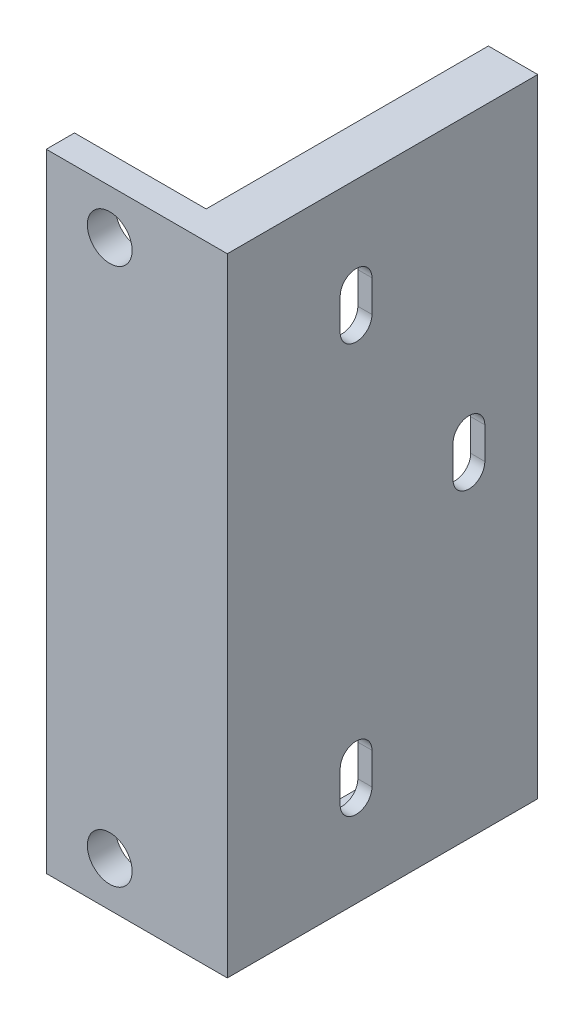
from build123d import *

# Parameters (mm, degrees)
SKETCH1_W           = 25.6624
SKETCH1_H           = 88.9
SKETCH1_R           = 3.175
BOSS_EXTRUDE1_DEPTH = 2
SKETCH2_W           = 2
SKETCH2_H           = 88.9
BOSS_EXTRUDE2_DEPTH = 40
CUT_EXTRUDE1_DEPTH  = 20
SKETCH8_W           = 40
SKETCH8_H           = 7
BOSS_EXTRUDE6_DEPTH = 5
BOSS_EXTRUDE8_START = 2
SKETCH9_W           = 25.6624
SKETCH9_H           = 88.9
SKETCH9_R           = 3.175
BOSS_EXTRUDE8_DEPTH = 2
BOSS_EXTRUDE5_START = 1
SKETCH7_W           = 25.6624
SKETCH7_H           = 88.9
SKETCH7_R           = 3.175
BOSS_EXTRUDE5_DEPTH = 1


with BuildPart() as part:
    # Sketch1 → Boss-Extrude1 (new body)
    with BuildSketch(Plane.XY):
        with Locations((3.8312, 0)):
            Rectangle(SKETCH1_W, SKETCH1_H)
        with Locations((0, -38.1)):
            Circle(SKETCH1_R, mode=Mode.SUBTRACT)
        with Locations((0, 38.1)):
            Circle(SKETCH1_R, mode=Mode.SUBTRACT)
    extrude(amount=-BOSS_EXTRUDE1_DEPTH)

    # Sketch2 → Boss-Extrude2 (add)
    with BuildSketch(Plane(origin=(0, 0, -2), x_dir=(-1, 0, 0), z_dir=(0, 0, -1))):
        with Locations((-15.6624, 0)):
            Rectangle(SKETCH2_W, SKETCH2_H)
    extrude(amount=BOSS_EXTRUDE2_DEPTH)

    # Sketch3 → Cut-Extrude1 (cut)
    with BuildSketch(Plane(origin=(16.6624, 0, 0), x_dir=(0, 0, -1), z_dir=(1, 0, 0))):
        with BuildLine():
            Line((14, -26.75), (14, -31.25))
            ThreePointArc((14, -31.25), (16.25, -33.5), (18.5, -31.25))
            Line((18.5, -31.25), (18.5, -26.75))
            ThreePointArc((18.5, -26.75), (16.25, -24.5), (14, -26.75))
        make_face()
        with BuildLine():
            Line((18.5, 26.75), (18.5, 31.25))
            ThreePointArc((18.5, 31.25), (16.25, 33.5), (14, 31.25))
            Line((14, 31.25), (14, 26.75))
            ThreePointArc((14, 26.75), (16.25, 24.5), (18.5, 26.75))
        make_face()
        with BuildLine():
            Line((30, 5.2), (30, 0.7))
            ThreePointArc((30, 0.7), (32.25, -1.55), (34.5, 0.7))
            Line((34.5, 0.7), (34.5, 5.2))
            ThreePointArc((34.5, 5.2), (32.25, 7.45), (30, 5.2))
        make_face()
    extrude(amount=-CUT_EXTRUDE1_DEPTH, mode=Mode.SUBTRACT)

    # Sketch8 → Boss-Extrude6 (add)
    with BuildSketch(Plane.ZY.offset(-14.6624)):
        with Locations((-22, -14.5)):
            Rectangle(SKETCH8_W, SKETCH8_H)
        with Locations((-22, 14.5)):
            Rectangle(SKETCH8_W, SKETCH8_H)
        with Locations((-22, 40.95)):
            Rectangle(SKETCH8_W, SKETCH8_H)
        with Locations((-22, -40.95)):
            Rectangle(SKETCH8_W, SKETCH8_H)
    extrude(amount=BOSS_EXTRUDE6_DEPTH)

    # Sketch9 → Boss-Extrude8 (add)
    with BuildSketch(Plane.XY.offset(BOSS_EXTRUDE8_START)):
        with Locations((3.8312, 0)):
            Rectangle(SKETCH9_W, SKETCH9_H)
        with Locations((0, -38.1)):
            Circle(SKETCH9_R, mode=Mode.SUBTRACT)
        with Locations((0, 38.1)):
            Circle(SKETCH9_R, mode=Mode.SUBTRACT)
    extrude(amount=-BOSS_EXTRUDE8_DEPTH)

    # Sketch7 → Boss-Extrude5 (add)
    with BuildSketch(Plane.XY.offset(BOSS_EXTRUDE5_START)):
        with Locations((3.8312, 0)):
            Rectangle(SKETCH7_W, SKETCH7_H)
        with Locations((0, -38.1)):
            Circle(SKETCH7_R, mode=Mode.SUBTRACT)
        with Locations((0, 38.1)):
            Circle(SKETCH7_R, mode=Mode.SUBTRACT)
    extrude(amount=-BOSS_EXTRUDE5_DEPTH)


solid = part.part
